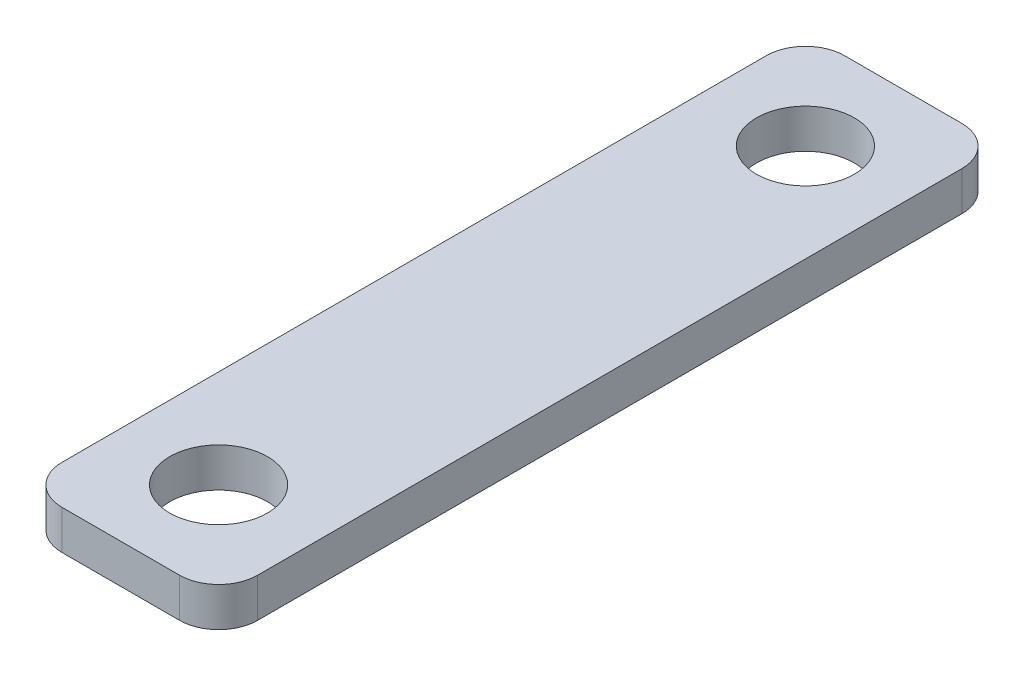
from build123d import *

# Parameters (mm, degrees)
SKETCH1_R           = 12.5
BOSS_EXTRUDE1_DEPTH = 10


with BuildPart() as part:
    # Sketch1 → Boss-Extrude1 (new body)
    with BuildSketch(Plane(origin=(0, 0, 0), x_dir=(1, 0, 0), z_dir=(0, 1, 0))):
        with BuildLine():
            Line((10, 0), (40, 0))
            ThreePointArc((40, 0), (47.071067812, 2.928932188), (50, 10))
            Line((50, 10), (50, 190))
            ThreePointArc((50, 190), (47.071067812, 197.071067812), (40, 200))
            Line((40, 200), (10, 200))
            ThreePointArc((10, 200), (2.928932188, 197.071067812), (0, 190))
            Line((0, 190), (0, 10))
            ThreePointArc((0, 10), (2.928932188, 2.928932188), (10, 0))
        make_face()
        with Locations(Location((25, 25, 0), (0, 0, 270))):
            Circle(SKETCH1_R, mode=Mode.SUBTRACT)
        with Locations(Location((25, 175, 0), (0, 0, 270))):
            Circle(SKETCH1_R, mode=Mode.SUBTRACT)
    extrude(amount=BOSS_EXTRUDE1_DEPTH)


solid = part.part
